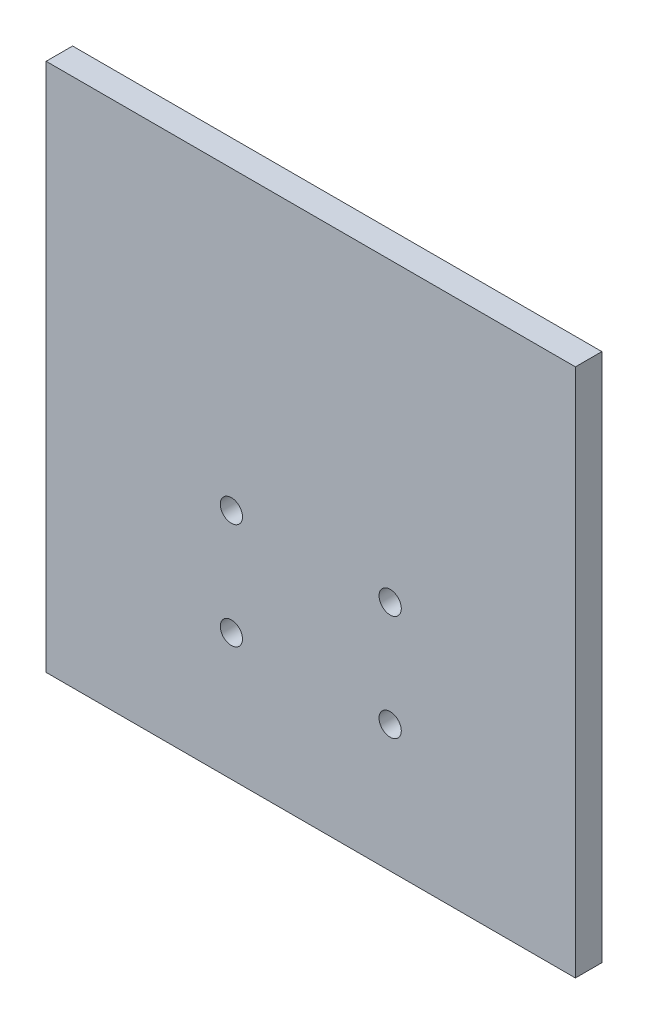
from build123d import *

# Parameters (mm, degrees)
SKETCH_1_W          = 100
SKETCH_1_H          = 100
EXTRUDE_1_DEPTH     = 5
CUT_EXTRUDE_2_DEPTH = 0.001
M4X0_7_HELICOIL_1_D = 4.2


with BuildPart() as part:
    # 스케치1 → 보스-돌출1 (new body)
    with BuildSketch(Plane.XY):
        Rectangle(SKETCH_1_W, SKETCH_1_H)
    extrude(amount=EXTRUDE_1_DEPTH)

    # 스케치3 → 컷-돌출2 (cut)
    # profile 1 of 5: a face of its own
    with BuildSketch(Plane(origin=(0, 0, 0), x_dir=(-1, 0, 0), z_dir=(0, 0, -1))):
        with BuildLine():
            Line((1.435897436, 3.568709936), (1.435897436, 3.241987179))
            add(Edge.make_bspline(
                [(1.435897436, 3.241987179), (1.406158657, 3.253938052), (1.349713836, 3.276621056), (1.26647346, 3.301285681), (1.189944626, 3.317221421), (1.140790736, 3.319457366), (1.117588141, 3.320512821)],
                knots=[0, 0, 0, 0, 1.16548392, 2.212112691, 3.15604595, 4, 4, 4, 4], degree=3))
            add(Edge.make_bspline(
                [(1.117588141, 3.320512821), (1.101914377, 3.31986148), (1.071575198, 3.318600703), (1.027971871, 3.312172427), (0.988682661, 3.299069626), (0.953777041, 3.28204035), (0.924826581, 3.260686166), (0.900040357, 3.239230902), (0.882073827, 3.215045722), (0.872318879, 3.192525311), (0.866368878, 3.171674318), (0.86457875, 3.150320052), (0.860193836, 3.124095966), (0.858971029, 3.091932248), (0.856183661, 3.054829537), (0.856430302, 3.012002641), (0.854146379, 2.964125498), (0.854488293, 2.930224949), (0.854667468, 2.912459936)],
                knots=[0, 0, 0, 0, 1.311993654, 2.539582093, 3.670788641, 4.763509788, 5.772417512, 6.671800701, 7.496729179, 8.266799162, 8.712543678, 9.304149002, 10.05334463, 10.934920737, 11.99209668, 13.165090968, 14.514413552, 16, 16, 16, 16], degree=3))
            Line((0.854667468, 2.912459936), (0.854667468, 2.557692308))
            Line((0.854667468, 2.557692308), (1.391025641, 2.557692308))
            Line((1.391025641, 2.557692308), (1.391025641, 2.243589744))
            Line((1.391025641, 2.243589744), (0.853966346, 2.243589744))
            Line((0.853966346, 2.243589744), (0.852564103, 0))
            Line((0.852564103, 0), (0.538461538, 0))
            Line((0.538461538, 0), (0.538461538, 2.243589744))
            Line((0.538461538, 2.243589744), (0.179487179, 2.243589744))
            Line((0.179487179, 2.243589744), (0.179487179, 2.557692308))
            Line((0.179487179, 2.557692308), (0.538461538, 2.557692308))
            Line((0.538461538, 2.557692308), (0.538461538, 2.966446314))
            add(Edge.make_bspline(
                [(0.538461538, 2.966446314), (0.538486753, 2.989121894), (0.538535124, 3.032622798), (0.541922975, 3.095232239), (0.544818696, 3.153055703), (0.550586323, 3.205644336), (0.557248029, 3.253490479), (0.566784189, 3.29588336), (0.57579556, 3.333965119), (0.592144152, 3.377067776), (0.616566371, 3.4259178), (0.656096568, 3.4775417), (0.703489575, 3.523846647), (0.760097899, 3.562854), (0.823813434, 3.595269478), (0.894694612, 3.618511331), (0.97196981, 3.631651776), (1.02545728, 3.633605985), (1.053084936, 3.634615385)],
                knots=[0, 0, 0, 0, 1.116398763, 2.141702935, 3.087165306, 3.966655413, 4.746276475, 5.464069668, 6.106083417, 6.67047701, 7.730773247, 8.782666744, 9.856985883, 10.980834087, 12.154321827, 13.366232824, 14.639591414, 16, 16, 16, 16], degree=3))
            add(Edge.make_bspline(
                [(1.053084936, 3.634615385), (1.081161694, 3.633658004), (1.140107358, 3.631648034), (1.232303961, 3.619214627), (1.331900478, 3.597743597), (1.400236399, 3.578665712), (1.435897436, 3.568709936)],
                knots=[0, 0, 0, 0, 0.864728408, 1.815451418, 2.859995356, 4, 4, 4, 4], degree=3))
        make_face()
    # profile 2 of 5: a face of its own
    with BuildSketch(Plane(origin=(0, 0, 0), x_dir=(-1, 0, 0), z_dir=(0, 0, -1))):
        with BuildLine():
            Line((1.794871795, 2.557692308), (2.108974359, 2.557692308))
            Line((2.108974359, 2.557692308), (2.108974359, 2.181189904))
            add(Edge.make_bspline(
                [(2.108974359, 2.181189904), (2.132163118, 2.216245732), (2.176511439, 2.283289731), (2.250224368, 2.371959032), (2.325727699, 2.445374079), (2.403382887, 2.503877598), (2.483760987, 2.547690717), (2.565097938, 2.579783752), (2.648673408, 2.598761067), (2.704835332, 2.601294726), (2.732972756, 2.602564103)],
                knots=[0, 0, 0, 0, 1.2804753, 2.448899062, 3.506932113, 4.484331642, 5.4025378, 6.288909075, 7.142734305, 8, 8, 8, 8], degree=3))
            add(Edge.make_bspline(
                [(2.732972756, 2.602564103), (2.754799083, 2.601373576), (2.799708168, 2.59892399), (2.867690758, 2.581713165), (2.93773421, 2.554235143), (2.982876597, 2.52839492), (3.006410256, 2.514923878)],
                knots=[0, 0, 0, 0, 0.901110191, 1.854092781, 2.881294221, 4, 4, 4, 4], degree=3))
            Line((3.006410256, 2.514923878), (2.833934295, 2.242888622))
            add(Edge.make_bspline(
                [(2.833934295, 2.242888622), (2.818825274, 2.249628888), (2.790145459, 2.262423203), (2.748190893, 2.277565213), (2.709509556, 2.286481129), (2.684865998, 2.287831847), (2.673377404, 2.288461538)],
                knots=[0, 0, 0, 0, 1.180555205, 2.24091978, 3.179933427, 4, 4, 4, 4], degree=3))
            add(Edge.make_bspline(
                [(2.673377404, 2.288461538), (2.64817167, 2.286781501), (2.59675928, 2.283354712), (2.521274781, 2.256415904), (2.448027575, 2.212890664), (2.389855913, 2.164619552), (2.34481366, 2.118071755), (2.312673435, 2.077423352), (2.283190688, 2.031844721), (2.255020467, 1.982115037), (2.229354173, 1.927385191), (2.205399504, 1.868201977), (2.183740641, 1.804496849), (2.171390397, 1.760114328), (2.165064103, 1.737379808)],
                knots=[0, 0, 0, 0, 1.125678352, 2.296057538, 3.5422874, 4.923748041, 5.663163013, 6.437101912, 7.23742474, 8.08941207, 8.991984279, 9.93940061, 10.944477711, 12, 12, 12, 12], degree=3))
            add(Edge.make_bspline(
                [(2.165064103, 1.737379808), (2.160331709, 1.717102634), (2.149849818, 1.672190235), (2.13965828, 1.596841711), (2.129588762, 1.507818052), (2.122492143, 1.404871459), (2.115914101, 1.288259015), (2.112204019, 1.15780307), (2.109100878, 1.013369718), (2.109017812, 0.912395365), (2.108974359, 0.859575321)],
                knots=[0, 0, 0, 0, 0.566838948, 1.255505196, 2.06880316, 3.007127437, 4.065329342, 5.249902469, 6.561414163, 8, 8, 8, 8], degree=3))
            Line((2.108974359, 0.859575321), (2.108974359, 0))
            Line((2.108974359, 0), (1.794871795, 0))
            Line((1.794871795, 0), (1.794871795, 2.557692308))
        make_face()
    # profile 3 of 5: a face of its own
    with BuildSketch(Plane(origin=(0, 0, 0), x_dir=(-1, 0, 0), z_dir=(0, 0, -1))):
        with BuildLine():
            add(Edge.make_bspline(
                [(4.555889423, 2.602564103), (4.603880696, 2.601542211), (4.697979853, 2.599538533), (4.835787739, 2.578123567), (4.967332875, 2.545376203), (5.093119067, 2.500104641), (5.211535363, 2.43942269), (5.324306607, 2.367013399), (5.431123616, 2.281230805), (5.495146645, 2.214872737), (5.527644231, 2.181189904)],
                knots=[0, 0, 0, 0, 1.054011418, 2.066658804, 3.057071809, 4.030435133, 4.997543892, 5.974964718, 6.972108034, 8, 8, 8, 8], degree=3))
            add(Edge.make_bspline(
                [(5.527644231, 2.181189904), (5.555626185, 2.148975918), (5.611048565, 2.085171376), (5.682114284, 1.981715763), (5.743335844, 1.874575662), (5.792398805, 1.762328336), (5.831083829, 1.645953664), (5.858549525, 1.525051653), (5.87488646, 1.399889306), (5.877089427, 1.314885468), (5.878205128, 1.271834936)],
                knots=[0, 0, 0, 0, 1.025258237, 2.030674902, 3.01204498, 3.988269485, 4.97094183, 5.956517959, 6.965070386, 8, 8, 8, 8], degree=3))
            add(Edge.make_bspline(
                [(5.878205128, 1.271834936), (5.877223791, 1.228534878), (5.875284623, 1.142971945), (5.856941006, 1.016952579), (5.82840992, 0.894757756), (5.787578082, 0.776899063), (5.735219973, 0.663016235), (5.671329285, 0.553606686), (5.595457668, 0.448454553), (5.509453671, 0.348452714), (5.414401795, 0.2562865), (5.311285647, 0.17595823), (5.202131613, 0.107136706), (5.08548826, 0.05170029), (4.962420773, 0.00799059), (4.832663705, -0.022709427), (4.696418635, -0.04127111), (4.603391413, -0.043654684), (4.555889423, -0.044871795)],
                knots=[0, 0, 0, 0, 0.998656419, 1.973391657, 2.932242238, 3.890759089, 4.846373663, 5.82037756, 6.809684879, 7.83454468, 8.860553229, 9.859544525, 10.845671541, 11.83227036, 12.833544569, 13.85385346, 14.904124723, 16, 16, 16, 16], degree=3))
            add(Edge.make_bspline(
                [(4.555889423, -0.044871795), (4.508154704, -0.043650599), (4.414663844, -0.041258824), (4.277937862, -0.022781541), (4.147948243, 0.007976441), (4.024719644, 0.051843934), (3.907574798, 0.107138478), (3.797788301, 0.175750167), (3.694588385, 0.256310322), (3.599516401, 0.348446259), (3.513517795, 0.448456216), (3.437644787, 0.553606254), (3.373754461, 0.663016348), (3.321396257, 0.776899033), (3.280564444, 0.894757764), (3.252033351, 1.016952577), (3.233689737, 1.142971945), (3.231750568, 1.228534878), (3.230769231, 1.271834936)],
                knots=[0, 0, 0, 0, 1.099876186, 2.154163076, 3.173186993, 4.173200201, 5.163417411, 6.152872554, 7.150605724, 8.17532212, 9.198891216, 10.186952605, 11.159729845, 12.11414092, 13.071450619, 14.029093627, 15.002601286, 16, 16, 16, 16], degree=3))
            add(Edge.make_bspline(
                [(3.230769231, 1.271834936), (3.231892541, 1.314651482), (3.234116503, 1.399420884), (3.250437012, 1.524347945), (3.277795568, 1.645045334), (3.316526965, 1.76097081), (3.366042155, 1.872726246), (3.426403443, 1.980131077), (3.498194076, 2.083118877), (3.553396027, 2.146840957), (3.581330128, 2.179086538)],
                knots=[0, 0, 0, 0, 1.031353054, 2.041901799, 3.029428768, 4.008703097, 4.981709435, 5.96992636, 6.972712378, 8, 8, 8, 8], degree=3))
            add(Edge.make_bspline(
                [(3.581330128, 2.179086538), (3.613778719, 2.213061478), (3.677594583, 2.279879174), (3.784943311, 2.365411698), (3.897437132, 2.439327772), (4.017162058, 2.498803987), (4.142844916, 2.545642505), (4.275064159, 2.57820802), (4.413339674, 2.599461375), (4.507899295, 2.601519553), (4.555889423, 2.602564103)],
                knots=[0, 0, 0, 0, 1.027980169, 2.021703884, 2.998553061, 3.971491411, 4.943284454, 5.930300938, 6.949603206, 8, 8, 8, 8], degree=3))
        make_face()
        with BuildLine():
            add(Edge.make_bspline(
                [(4.554487179, 2.288461538), (4.520549568, 2.287496947), (4.453550439, 2.285592664), (4.354930855, 2.27110876), (4.259990701, 2.248161255), (4.168549857, 2.215557199), (4.080916684, 2.1734583), (3.997007282, 2.12174994), (3.916574842, 2.061116984), (3.841192779, 1.991654312), (3.772010466, 1.915775317), (3.71153249, 1.834926959), (3.660107384, 1.750420612), (3.617267225, 1.662168401), (3.585360036, 1.569275987), (3.562187014, 1.472795356), (3.547716774, 1.37252994), (3.545830395, 1.304368921), (3.544871795, 1.269731571)],
                knots=[0, 0, 0, 0, 1.021534396, 2.016698045, 2.994645724, 3.958388632, 4.93408049, 5.916473867, 6.921342795, 7.962252576, 8.998418191, 10.008913653, 10.997312074, 11.973003931, 12.956656626, 13.948281152, 14.957379055, 16, 16, 16, 16], degree=3))
            add(Edge.make_bspline(
                [(3.544871795, 1.269731571), (3.546478619, 1.224979543), (3.549667863, 1.136155138), (3.575603099, 1.005344015), (3.618989379, 0.879762163), (3.677576659, 0.760145777), (3.750982878, 0.649473499), (3.837469944, 0.550802015), (3.936109645, 0.465616203), (4.045726145, 0.394935358), (4.164080463, 0.338775602), (4.289336784, 0.298976626), (4.419977478, 0.273104934), (4.509258209, 0.270533459), (4.554487179, 0.269230769)],
                knots=[0, 0, 0, 0, 1.016792936, 2.018143844, 3.017858371, 4.030088057, 5.03801393, 6.028138512, 7.003788237, 7.991172063, 8.984598303, 9.972568034, 10.972917682, 12, 12, 12, 12], degree=3))
            add(Edge.make_bspline(
                [(4.554487179, 0.269230769), (4.599713548, 0.270541049), (4.688989144, 0.273127506), (4.819448321, 0.298846326), (4.944362293, 0.338949987), (5.062593681, 0.394872197), (5.172160284, 0.465884611), (5.271509405, 0.550320988), (5.357258017, 0.64973484), (5.430591621, 0.760292369), (5.490138364, 0.879576721), (5.533321566, 1.005367193), (5.559319152, 1.136149235), (5.562499981, 1.224977566), (5.564102564, 1.269731571)],
                knots=[0, 0, 0, 0, 1.02726834, 2.027799167, 3.010890988, 4.004497153, 4.992059811, 5.971914811, 6.958719428, 7.966827853, 8.981595046, 9.981490638, 10.983022906, 12, 12, 12, 12], degree=3))
            add(Edge.make_bspline(
                [(5.564102564, 1.269731571), (5.563144294, 1.304369128), (5.561258565, 1.372530554), (5.546783601, 1.472793007), (5.523628061, 1.569284604), (5.491656444, 1.662136607), (5.44900243, 1.750649112), (5.396585637, 1.834678839), (5.336354611, 1.916055385), (5.26633749, 1.991409026), (5.191034113, 2.061144062), (5.110569074, 2.121773452), (5.026784096, 2.173231047), (4.939405513, 2.215917288), (4.847952945, 2.247864628), (4.753145816, 2.271241259), (4.654947006, 2.285531456), (4.588187963, 2.287478598), (4.554487179, 2.288461538)],
                knots=[0, 0, 0, 0, 1.042956736, 2.052379634, 3.044323526, 4.02829302, 5.004299113, 5.996692471, 7.007513377, 8.048758398, 9.090003419, 10.095195979, 11.07790575, 12.047570684, 13.018257071, 13.989683339, 14.985167495, 16, 16, 16, 16], degree=3))
        make_face(mode=Mode.SUBTRACT)
    # profile 4 of 5: a face of its own
    with BuildSketch(Plane(origin=(0, 0, 0), x_dir=(-1, 0, 0), z_dir=(0, 0, -1))):
        with BuildLine():
            Line((6.506410256, 2.557692308), (6.820512821, 2.557692308))
            Line((6.820512821, 2.557692308), (6.820512821, 2.096354167))
            add(Edge.make_bspline(
                [(6.820512821, 2.096354167), (6.854050456, 2.13819689), (6.919131407, 2.219394153), (7.02751574, 2.326114728), (7.14205964, 2.414059953), (7.262061644, 2.484163747), (7.387684654, 2.537010373), (7.518162924, 2.575176304), (7.65427763, 2.598061132), (7.746842067, 2.601051363), (7.793669872, 2.602564103)],
                knots=[0, 0, 0, 0, 1.12780773, 2.188550248, 3.19190651, 4.159438251, 5.104880172, 6.052711206, 7.014878035, 8, 8, 8, 8], degree=3))
            add(Edge.make_bspline(
                [(7.793669872, 2.602564103), (7.841000506, 2.600818907), (7.933637974, 2.597403139), (8.068516035, 2.570386448), (8.194489429, 2.524241192), (8.311108985, 2.461029122), (8.416236198, 2.382422649), (8.508561049, 2.290844867), (8.584924297, 2.185508784), (8.63612166, 2.087785627), (8.669847307, 2.001096833), (8.691079645, 1.926850083), (8.709110626, 1.844131932), (8.724742374, 1.753192343), (8.735319486, 1.653394153), (8.743661778, 1.545146461), (8.749640472, 1.42848433), (8.749877679, 1.347797703), (8.75, 1.306189904)],
                knots=[0, 0, 0, 0, 1.235846778, 2.418850247, 3.575807741, 4.728682307, 5.871620074, 6.994088408, 8.11269785, 9.256955736, 9.865816715, 10.540099792, 11.271859618, 12.076849838, 12.949306005, 13.892391288, 14.913166135, 16, 16, 16, 16], degree=3))
            Line((8.75, 1.306189904), (8.75, 0))
            Line((8.75, 0), (8.435897436, 0))
            Line((8.435897436, 0), (8.435897436, 1.203125))
            add(Edge.make_bspline(
                [(8.435897436, 1.203125), (8.435704228, 1.237947445), (8.435334654, 1.304556856), (8.434169007, 1.399925879), (8.431359201, 1.486412457), (8.427410888, 1.563809825), (8.421631857, 1.632043661), (8.415609226, 1.691252938), (8.408244249, 1.74136248), (8.401681336, 1.771527563), (8.398737981, 1.78505609)],
                knots=[0, 0, 0, 0, 1.430800155, 2.736877192, 3.918605307, 4.986035426, 5.920637409, 6.731861385, 7.431261377, 8, 8, 8, 8], degree=3))
            add(Edge.make_bspline(
                [(8.398737981, 1.78505609), (8.388112449, 1.824767275), (8.367661589, 1.901199019), (8.317127605, 2.004873372), (8.253313425, 2.09307156), (8.175415575, 2.165248281), (8.0841865, 2.221419118), (7.979879357, 2.260393073), (7.863500716, 2.284769342), (7.781646334, 2.287196474), (7.738982372, 2.288461538)],
                knots=[0, 0, 0, 0, 1.084156227, 2.086665306, 3.027808233, 3.945421172, 4.874247719, 5.839848303, 6.874090471, 8, 8, 8, 8], degree=3))
            add(Edge.make_bspline(
                [(7.738982372, 2.288461538), (7.713714688, 2.287985534), (7.663710595, 2.287043533), (7.589560623, 2.277592235), (7.51763645, 2.262133779), (7.447216241, 2.241265142), (7.379708447, 2.212602873), (7.312944156, 2.180073502), (7.249437392, 2.13952529), (7.187833995, 2.094334669), (7.130521187, 2.044255462), (7.077192849, 1.991410952), (7.029654829, 1.935135348), (6.986586153, 1.8763354), (6.94940789, 1.814203562), (6.916954802, 1.749339256), (6.889419107, 1.681657107), (6.875736415, 1.634682046), (6.868890224, 1.611177885)],
                knots=[0, 0, 0, 0, 1.023777757, 2.026029729, 3.023749952, 4.003683103, 4.997618607, 5.993177895, 7.010360494, 8.046726602, 9.087585522, 10.09234134, 11.086953743, 12.070360549, 13.043493632, 14.017870808, 15.008233677, 16, 16, 16, 16], degree=3))
            add(Edge.make_bspline(
                [(6.868890224, 1.611177885), (6.864950576, 1.593922682), (6.856374167, 1.556359007), (6.847110987, 1.494714588), (6.838703412, 1.423404613), (6.831666453, 1.342512296), (6.827361037, 1.251754421), (6.82266664, 1.151518583), (6.820957579, 1.041405094), (6.820665225, 0.964743402), (6.820512821, 0.924779647)],
                knots=[0, 0, 0, 0, 0.615963638, 1.340920617, 2.168419149, 3.115676021, 4.16674242, 5.331190069, 6.6087489, 8, 8, 8, 8], degree=3))
            Line((6.820512821, 0.924779647), (6.820512821, 0))
            Line((6.820512821, 0), (6.506410256, 0))
            Line((6.506410256, 0), (6.506410256, 2.557692308))
        make_face()
    # profile 5 of 5: a face of its own
    with BuildSketch(Plane(origin=(0, 0, 0), x_dir=(-1, 0, 0), z_dir=(0, 0, -1))):
        Polygon((9.782051282, 3.58974359), (10.096153846, 3.58974359), (10.096153846, 2.557692308), (10.544871795, 2.557692308), (10.544871795, 2.243589744), (10.096153846, 2.243589744), (10.096153846, 0), (9.782051282, 0), (9.782051282, 2.243589744), (9.333333333, 2.243589744), (9.333333333, 2.557692308), (9.782051282, 2.557692308), align=None)
    extrude(amount=-CUT_EXTRUDE_2_DEPTH, mode=Mode.SUBTRACT)

    # M4x0.7 Helicoil용 탭 구멍1 (through all)
    with Locations(Plane(origin=(0, 0, -5), x_dir=(-1, 0, 0), z_dir=(0, 0, -1))):
        with Locations((-15, -26), (15, -26), (-15, -6), (15, -6)):
            Hole(M4X0_7_HELICOIL_1_D / 2)


solid = part.part
